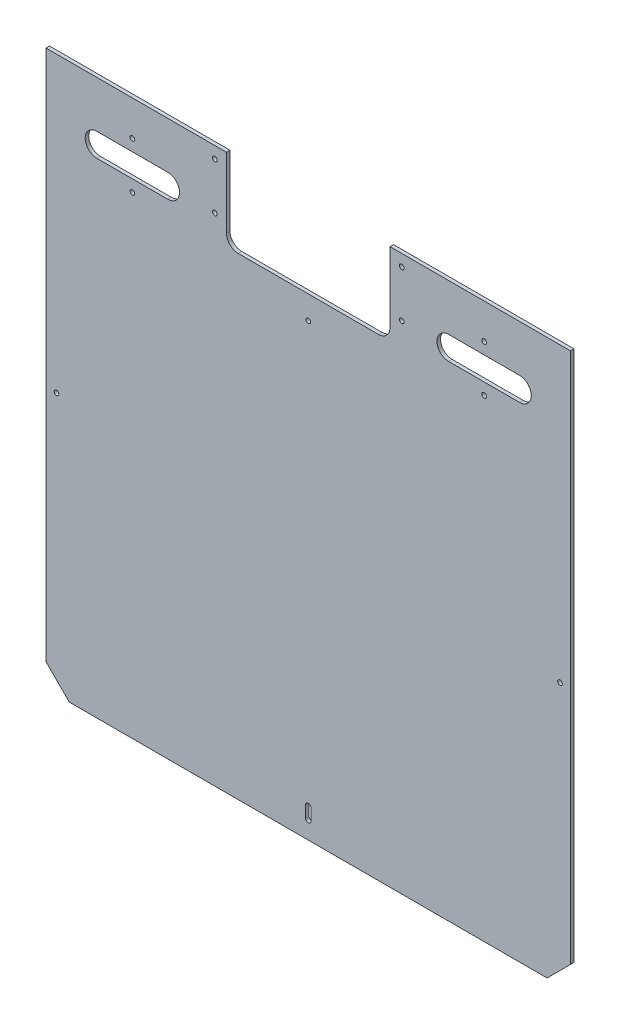
from build123d import *

# Parameters (mm, degrees)
SCHIZZO1_R                   = 2
ESTRUSIONE_ESTRUSIONE1_DEPTH = 3


with BuildPart() as part:
    # Schizzo1 → Estrusione-Estrusione1 (new body)
    with BuildSketch(Plane.XY):
        with BuildLine():
            Line((0, 20), (0, 475))
            Line((0, 475), (154.5, 475))
            Line((154.5, 475), (154.5, 415))
            ThreePointArc((154.5, 415), (157.428932188, 407.928932188), (164.5, 405))
            Line((164.5, 405), (284.5, 405))
            ThreePointArc((284.5, 405), (291.571067812, 407.928932188), (294.5, 415))
            Line((294.5, 415), (294.5, 475))
            Line((294.5, 475), (449, 475))
            Line((449, 475), (449, 20))
            Line((449, 20), (429, 0))
            Line((429, 0), (20, 0))
            Line((20, 0), (0, 20))
        make_face()
        with Locations((144.5, 425)):
            Circle(SCHIZZO1_R, mode=Mode.SUBTRACT)
        with Locations((224.5, 385)):
            Circle(SCHIZZO1_R, mode=Mode.SUBTRACT)
        with Locations((73.921872489, 445)):
            Circle(SCHIZZO1_R, mode=Mode.SUBTRACT)
        with Locations((9, 223.826386399)):
            Circle(SCHIZZO1_R, mode=Mode.SUBTRACT)
        with Locations((440, 224.5)):
            Circle(SCHIZZO1_R, mode=Mode.SUBTRACT)
        with Locations(Location((73.921872489, 405, 0), (0, 0, 180))):
            Circle(SCHIZZO1_R, mode=Mode.SUBTRACT)
        with Locations((375.078127511, 405)):
            Circle(SCHIZZO1_R, mode=Mode.SUBTRACT)
        with Locations(Location((375.078127511, 445, 0), (0, 0, 180))):
            Circle(SCHIZZO1_R, mode=Mode.SUBTRACT)
        with Locations(Location((144.5, 465, 0), (0, 0, 180))):
            Circle(SCHIZZO1_R, mode=Mode.SUBTRACT)
        with Locations(Location((304.5, 425, 0), (0, 0, 180))):
            Circle(SCHIZZO1_R, mode=Mode.SUBTRACT)
        with Locations((304.5, 465)):
            Circle(SCHIZZO1_R, mode=Mode.SUBTRACT)
        with BuildLine():
            Line((344.715899345, 435), (405.440355678, 435))
            ThreePointArc((405.440355678, 435), (415.440355678, 425), (405.440355678, 415))
            Line((405.440355678, 415), (344.715899345, 415))
            ThreePointArc((344.715899345, 415), (334.715899345, 425), (344.715899345, 435))
        make_face(mode=Mode.SUBTRACT)
        with BuildLine():
            Line((104.284100655, 435), (43.559644322, 435))
            ThreePointArc((43.559644322, 435), (33.559644322, 425), (43.559644322, 415))
            Line((43.559644322, 415), (104.284100655, 415))
            ThreePointArc((104.284100655, 415), (114.284100655, 425), (104.284100655, 435))
        make_face(mode=Mode.SUBTRACT)
        with BuildLine():
            Line((222.25, 15), (222.25, 25))
            ThreePointArc((222.25, 25), (224.5, 27.25), (226.75, 25))
            Line((226.75, 25), (226.75, 15))
            ThreePointArc((226.75, 15), (224.5, 12.75), (222.25, 15))
        make_face(mode=Mode.SUBTRACT)
    extrude(amount=ESTRUSIONE_ESTRUSIONE1_DEPTH)


solid = part.part
